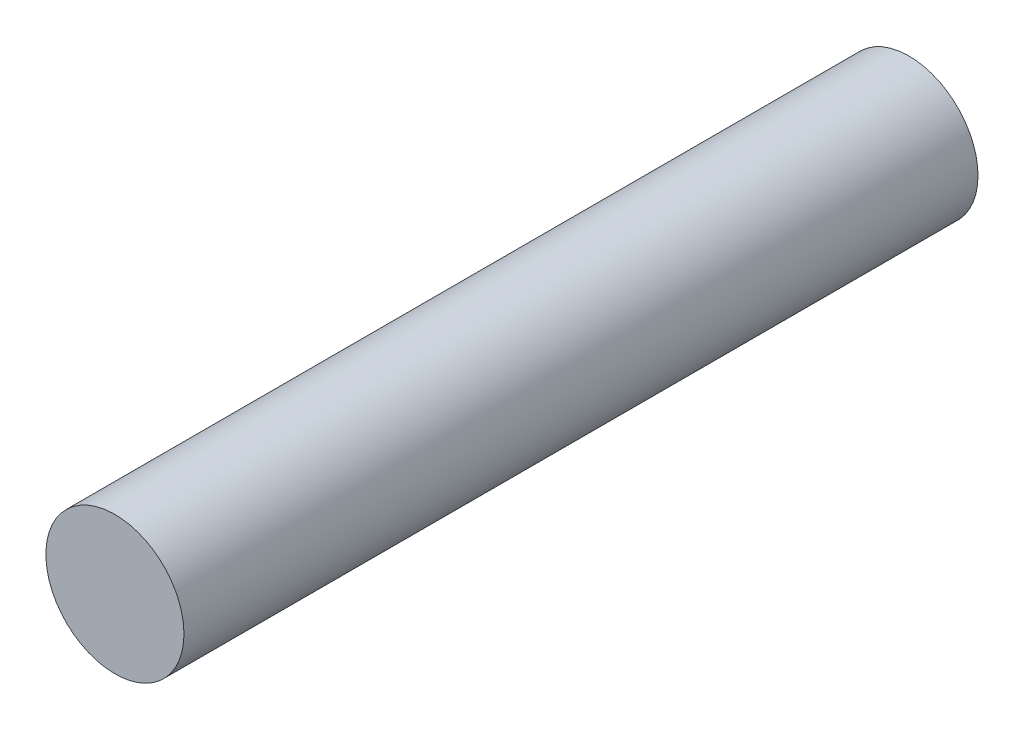
from build123d import *

# Parameters (mm, degrees)
SKETCH1_R           = 2
BOSS_EXTRUDE1_DEPTH = 23


with BuildPart() as part:
    # Sketch1 → Boss-Extrude1 (new body)
    with BuildSketch(Plane.XY):
        Circle(SKETCH1_R)
    extrude(amount=BOSS_EXTRUDE1_DEPTH)


solid = part.part
